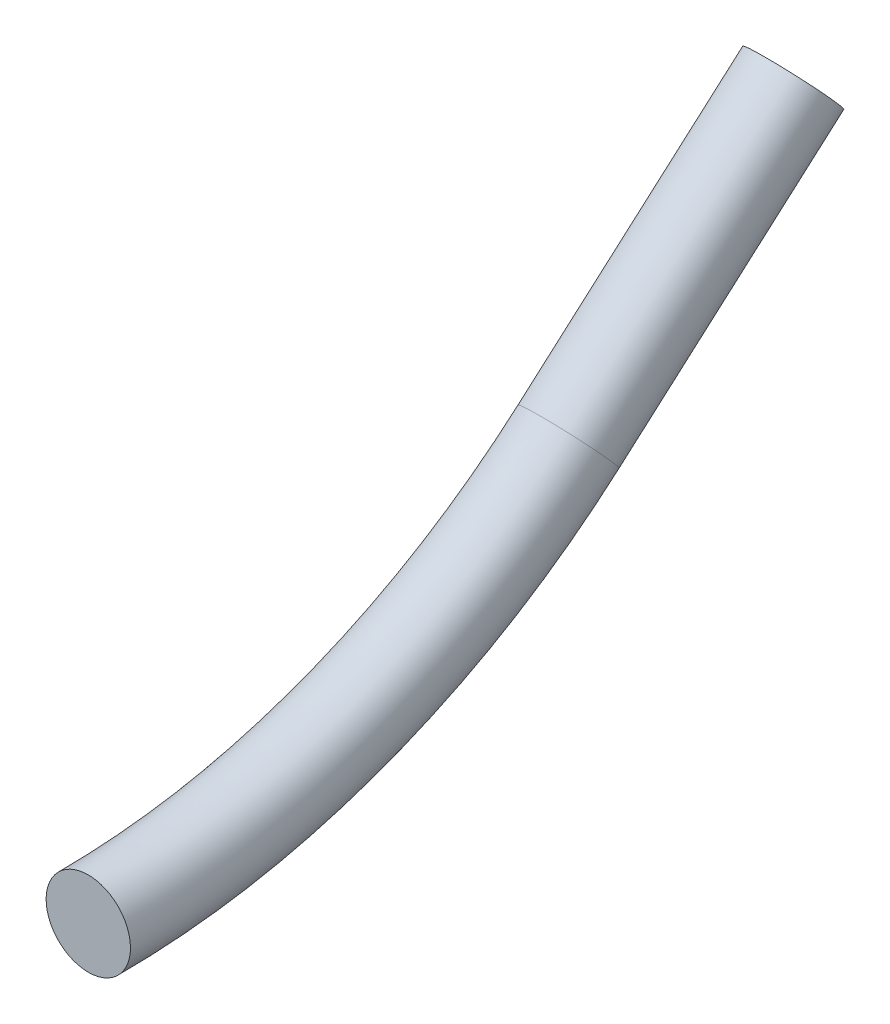
from build123d import *

# Parameters (mm, degrees)
SKETCH2_R = 85.725


with BuildPart() as part:
    # Sweep1: sweep along a path in Sketch1
    with BuildLine(Plane(origin=(0, 0, 0), x_dir=(0, 0, -1), z_dir=(1, 0, 0))) as sweep1_path:
        Line((-298.774200825, -263.730143172), (-755.795022795, -667.145720816))
        ThreePointArc((-755.795022795, -667.145720816), (-1210.15703981, -940.978221258), (-1732.009400098, -1036.367921258))
    # Sketch2 → Sweep1 (sweep)
    with BuildSketch(Plane(origin=(0, -263.730143172, 298.774200825), x_dir=(1, 0, 0), z_dir=(0, -0.6617709607020791, 0.7497060727854933))):
        Circle(SKETCH2_R)
    sweep(path=sweep1_path.line)


solid = part.part
